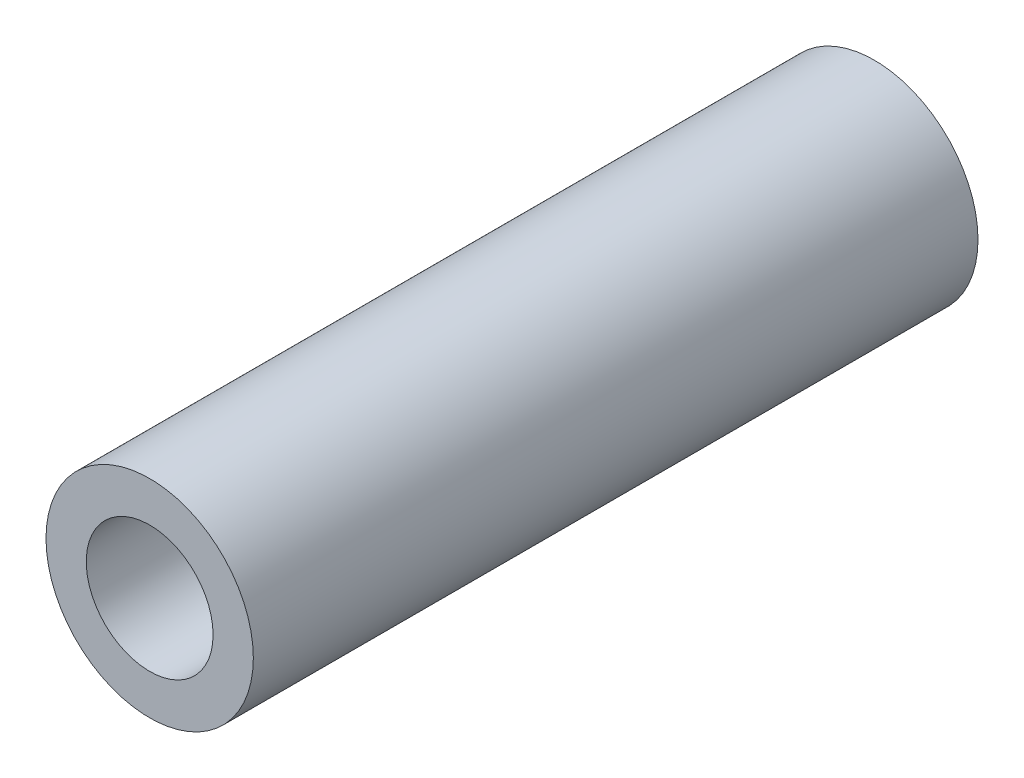
from build123d import *

# Parameters (mm, degrees)
SKETCH1_R           = 2.575
BOSS_EXTRUDE1_DEPTH = 18
CUT_EXTRUDE1_REACH  = 41.508
SKETCH3_R           = 1.575


with BuildPart() as part:
    # Sketch1 → Boss-Extrude1 (new body)
    with BuildSketch(Plane.XY):
        with Locations((32.5, 0)):
            Circle(SKETCH1_R)
    extrude(amount=BOSS_EXTRUDE1_DEPTH)

    # Sketch3 → Cut-Extrude1 (cut, up to next)
    with BuildSketch(Plane.XY.offset(18), mode=Mode.PRIVATE) as cut_extrude1_sk1:
        with Locations((32.5, 0)):
            Circle(SKETCH3_R)
    cut_extrude1_tool1 = extrude(cut_extrude1_sk1.sketch, amount=-CUT_EXTRUDE1_REACH, mode=Mode.PRIVATE) & part.part
    add(cut_extrude1_tool1.solids().sort_by_distance((32.5, 0, 18))[0], mode=Mode.SUBTRACT)


solid = part.part
